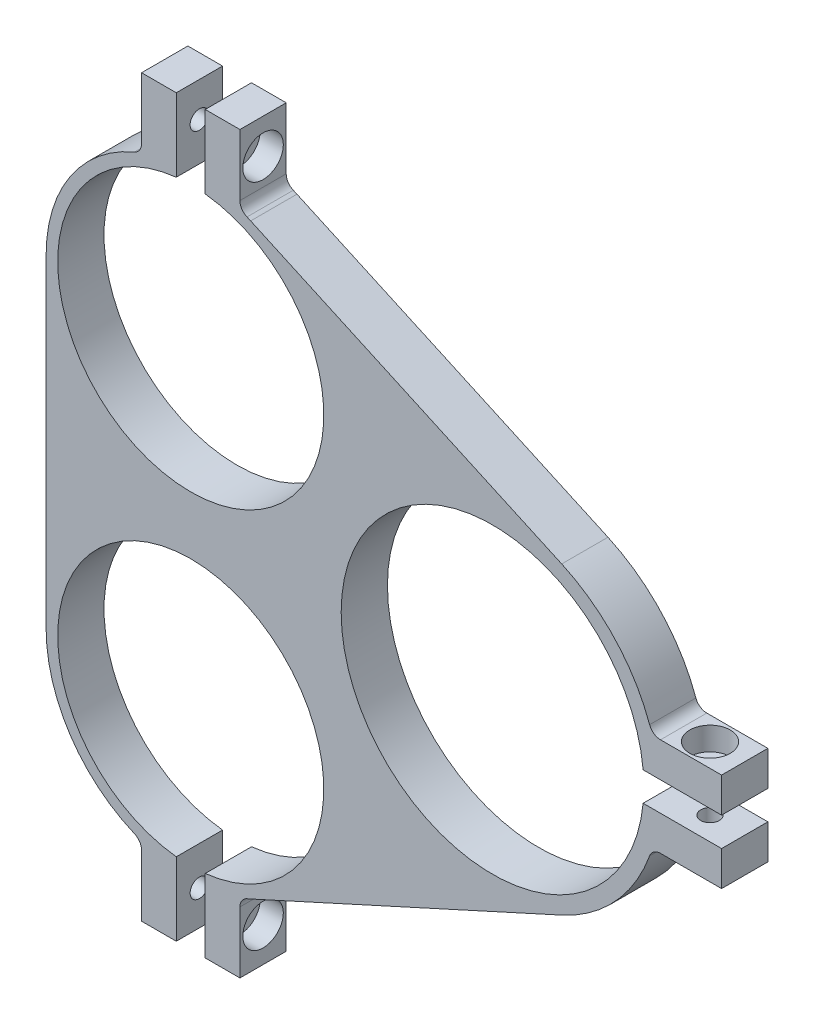
from build123d import *

# Parameters (mm, degrees)
EXTRUDE1_DEPTH                                   = 6.35
CBORE_FOR_1_4_SOCKET_HEAD_CAP_SCREW1_D           = 6.7564
CBORE_FOR_1_4_SOCKET_HEAD_CAP_SCREW1_DEPTH       = 9.525
CBORE_FOR_1_4_SOCKET_HEAD_CAP_SCREW1_CBORE_D     = 11.1125
CBORE_FOR_1_4_SOCKET_HEAD_CAP_SCREW1_CBORE_DEPTH = 6.35
F_1_4_20_TAPPED_HOLE1_D                          = 5.1054
CBORE_FOR_1_4_SOCKET_HEAD_CAP_SCREW3_D           = 6.7564
CBORE_FOR_1_4_SOCKET_HEAD_CAP_SCREW3_DEPTH       = 9.525
CBORE_FOR_1_4_SOCKET_HEAD_CAP_SCREW3_CBORE_D     = 11.1125
CBORE_FOR_1_4_SOCKET_HEAD_CAP_SCREW3_CBORE_DEPTH = 6.35
F_1_4_20_TAPPED_HOLE4_D                          = 5.1054
CBORE_FOR_1_4_SOCKET_HEAD_CAP_SCREW6_D           = 6.7564
CBORE_FOR_1_4_SOCKET_HEAD_CAP_SCREW6_DEPTH       = 9.525
CBORE_FOR_1_4_SOCKET_HEAD_CAP_SCREW6_CBORE_D     = 11.1125
CBORE_FOR_1_4_SOCKET_HEAD_CAP_SCREW6_CBORE_DEPTH = 6.35
F_1_4_20_TAPPED_HOLE7_D                          = 5.1054
FILLET1_R                                        = 3.175


with BuildPart() as part:
    # Sketch1 → Extrude1 (new, symmetric)
    with BuildSketch(Plane.XY):
        with BuildLine():
            Line((-39.6875, 88.9), (-39.6875, 0))
            ThreePointArc((-39.6875, 0), (-32.485618813, -22.798733003), (-13.49375, -37.323134477))
            Line((-13.49375, -37.323134477), (-13.49375, -56.373134477))
            Line((-13.49375, -56.373134477), (-3.96875, -56.373134477))
            Line((-3.96875, -56.373134477), (-3.96875, -36.296166184))
            ThreePointArc((-3.96875, -36.296166184), (0, 36.5125), (3.96875, -36.296166184))
            Line((3.96875, -36.296166184), (3.96875, -56.373134477))
            Line((3.96875, -56.373134477), (13.49375, -56.373134477))
            Line((13.49375, -56.373134477), (13.49375, -37.323134477))
            ThreePointArc((13.49375, -37.323134477), (14.978378625, -36.752494201), (16.438950589, -36.122826022))
            Line((16.438950589, -36.122826022), (101.793886149, 2.72091138))
            ThreePointArc((101.793886149, 2.72091138), (117.234328534, 14.176693941), (126.619887312, 30.95625))
            Line((126.619887312, 30.95625), (145.669887312, 30.95625))
            Line((145.669887312, 30.95625), (145.669887312, 40.48125))
            Line((145.669887312, 40.48125), (124.142537174, 40.48125))
            ThreePointArc((124.142537174, 40.48125), (41.274610429, 44.45), (124.142537174, 48.41875))
            Line((124.142537174, 48.41875), (145.669887312, 48.41875))
            Line((145.669887312, 48.41875), (145.669887312, 57.94375))
            Line((145.669887312, 57.94375), (126.619887312, 57.94375))
            ThreePointArc((126.619887312, 57.94375), (117.234328534, 74.723306059), (101.793886149, 86.17908862))
            Line((101.793886149, 86.17908862), (16.438950589, 125.022826022))
            ThreePointArc((16.438950589, 125.022826022), (14.978378625, 125.652494201), (13.49375, 126.223134477))
            Line((13.49375, 126.223134477), (13.49375, 145.273134477))
            Line((13.49375, 145.273134477), (3.96875, 145.273134477))
            Line((3.96875, 145.273134477), (3.96875, 125.196166184))
            ThreePointArc((3.96875, 125.196166184), (0, 52.3875), (-3.96875, 125.196166184))
            Line((-3.96875, 125.196166184), (-3.96875, 145.273134477))
            Line((-3.96875, 145.273134477), (-13.49375, 145.273134477))
            Line((-13.49375, 145.273134477), (-13.49375, 126.223134477))
            ThreePointArc((-13.49375, 126.223134477), (-32.485618813, 111.698733003), (-39.6875, 88.9))
        make_face()
    extrude(amount=EXTRUDE1_DEPTH, both=True)

    # CBORE for 1/4 Socket Head Cap Screw1
    with Locations(Plane(origin=(13.49375, 0, 0), x_dir=(0, 0, -1), z_dir=(1, 0, 0))):
        with Locations((0, 135.748134477)):
            CounterBoreHole(CBORE_FOR_1_4_SOCKET_HEAD_CAP_SCREW1_D / 2, CBORE_FOR_1_4_SOCKET_HEAD_CAP_SCREW1_CBORE_D / 2, CBORE_FOR_1_4_SOCKET_HEAD_CAP_SCREW1_CBORE_DEPTH, depth=CBORE_FOR_1_4_SOCKET_HEAD_CAP_SCREW1_DEPTH)

    # 1/4-20 Tapped Hole1 (through all)
    with Locations(Plane(origin=(-3.96875, 0, 0), x_dir=(0, 0, -1), z_dir=(1, 0, 0))):
        with Locations((0, 135.748134477)):
            Hole(F_1_4_20_TAPPED_HOLE1_D / 2)

    # CBORE for 1/4 Socket Head Cap Screw3
    with Locations(Plane(origin=(13.49375, 0, 0), x_dir=(0, 0, -1), z_dir=(1, 0, 0))):
        with Locations((0, -46.848134477)):
            CounterBoreHole(CBORE_FOR_1_4_SOCKET_HEAD_CAP_SCREW3_D / 2, CBORE_FOR_1_4_SOCKET_HEAD_CAP_SCREW3_CBORE_D / 2, CBORE_FOR_1_4_SOCKET_HEAD_CAP_SCREW3_CBORE_DEPTH, depth=CBORE_FOR_1_4_SOCKET_HEAD_CAP_SCREW3_DEPTH)

    # 1/4-20 Tapped Hole4 (through all)
    with Locations(Plane(origin=(-3.96875, 0, 0), x_dir=(0, 0, -1), z_dir=(1, 0, 0))):
        with Locations((0, -46.848134477)):
            Hole(F_1_4_20_TAPPED_HOLE4_D / 2)

    # CBORE for 1/4 Socket Head Cap Screw6
    with Locations(Plane(origin=(0, 57.94375, 0), x_dir=(1, 0, 0), z_dir=(0, 1, 0))):
        with Locations((136.144887312, 0)):
            CounterBoreHole(CBORE_FOR_1_4_SOCKET_HEAD_CAP_SCREW6_D / 2, CBORE_FOR_1_4_SOCKET_HEAD_CAP_SCREW6_CBORE_D / 2, CBORE_FOR_1_4_SOCKET_HEAD_CAP_SCREW6_CBORE_DEPTH, depth=CBORE_FOR_1_4_SOCKET_HEAD_CAP_SCREW6_DEPTH)

    # 1/4-20 Tapped Hole7 (through all)
    with Locations(Plane(origin=(0, 40.48125, 0), x_dir=(1, 0, 0), z_dir=(0, 1, 0))):
        with Locations((136.144887312, 0)):
            Hole(F_1_4_20_TAPPED_HOLE7_D / 2)

    # Fillet1
    fillet1_edges = [part.edges().sort_by_distance(p)[0] for p in [
        (-13.49375, 126.223134477, 0),
        (13.49375, 126.223134477, 0),
        (126.619887312, 57.94375, 0),
        (126.619887312, 30.95625, 0),
        (13.49375, -37.323134477, 0),
        (-13.49375, -37.323134477, 0),
    ]]
    fillet(fillet1_edges, radius=FILLET1_R)


solid = part.part
